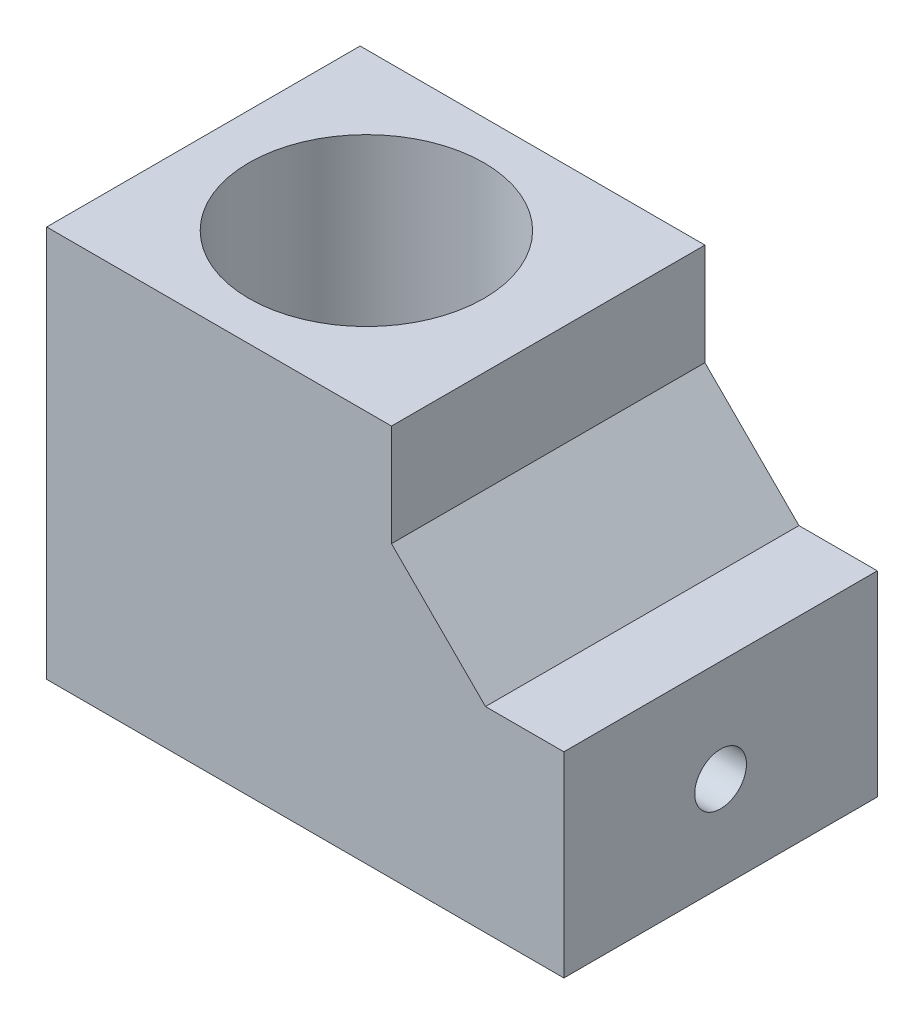
from build123d import *

# Parameters (mm, degrees)
ESTRUSIONE_ESTRUSIONE1_DEPTH = 20
SCHIZZO2_R                   = 7.5
TAGLIO_ESTRUSIONE1_DEPTH     = 46.97825573
FORO_FILETTATO_M4_1_D        = 3.3
FORO_FILETTATO_M4_1_DEPTH    = 10.1
FORO_FILETTATO_M4_1_TIP      = 0.991420021


with BuildPart() as part:
    # Schizzo1 → Estrusione-Estrusione1 (new body)
    with BuildSketch(Plane.XY):
        Polygon((0, 0), (33, 0), (33, 12.5), (28, 12.5), (22, 18.5), (22, 25), (0, 25), align=None)
    extrude(amount=-ESTRUSIONE_ESTRUSIONE1_DEPTH)

    # Schizzo2 → Taglio-Estrusione1 (cut, through all)
    with BuildSketch(Plane.XZ):
        with Locations((10.4, -10)):
            Circle(SCHIZZO2_R)
    extrude(amount=-TAGLIO_ESTRUSIONE1_DEPTH, mode=Mode.SUBTRACT)

    # Foro filettato M4-1
    with Locations(Plane(origin=(33, 0, 0), x_dir=(0, 0, -1), z_dir=(1, 0, 0))):
        with Locations((10, 6)):
            Hole(FORO_FILETTATO_M4_1_D / 2, depth=FORO_FILETTATO_M4_1_DEPTH)
            with Locations((0, 0, -(FORO_FILETTATO_M4_1_DEPTH + FORO_FILETTATO_M4_1_TIP / 2))):  # 118° drill point
                Cone(0, FORO_FILETTATO_M4_1_D / 2, FORO_FILETTATO_M4_1_TIP, mode=Mode.SUBTRACT)


solid = part.part
